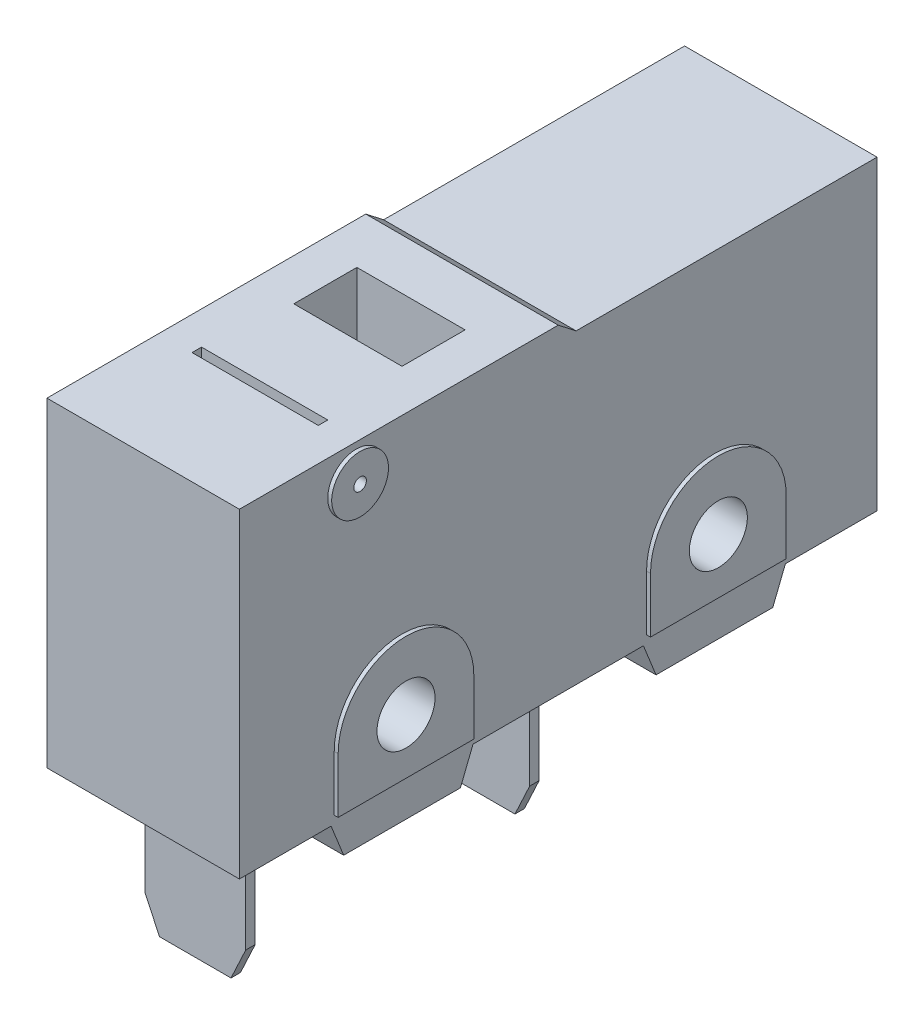
from build123d import *
from OCP.BRepFilletAPI import BRepFilletAPI_MakeChamfer

# Parameters (mm, degrees)
SKETCH1_W               = 20.21
SKETCH1_H               = 9.71
BOSS_EXTRUDE1_DEPTH     = 3.05
BOSS_EXTRUDE2_DEPTH     = 3.05
BOSS_EXTRUDE3_DEPTH     = 3.175
CUT_EXTRUDE1_DEPTH      = 13.102589599
CUT_EXTRUDE1_DEPTH_BACK = 13.102589599
MOUNTING_HOLES_R        = 0.92
SKETCH5_R               = 0.9
BOSS_EXTRUDE4_DEPTH     = 3.175
CUT_EXTRUDE2_DEPTH      = 13.102589599
CUT_EXTRUDE2_DEPTH_BACK = 13.102589599
SKETCH6_R               = 0.2
SKETCH7_W               = 4
SKETCH7_H               = 0.3
CUT_EXTRUDE3_DEPTH      = 5
SKETCH8_W               = 3.43
SKETCH8_H               = 2
CUT_EXTRUDE4_DEPTH      = 4
SKETCH9_W               = 3.2
SKETCH9_H               = 0.3
BOSS_EXTRUDE5_DEPTH     = 4.5
BOSS_EXTRUDE5_2_DEPTH   = 4.5
CHAMFER1_SIZE           = 1
CHAMFER1_SIZE2          = 0.466307658
CHAMFER2_SIZE           = 1
CHAMFER2_SIZE2          = 0.466307658


with BuildPart() as part:
    # Sketch1 → Boss-Extrude1 (new, symmetric)
    with BuildSketch(Plane(origin=(0, 0, 0), x_dir=(0, 0, -1), z_dir=(1, 0, 0))):
        Rectangle(SKETCH1_W, SKETCH1_H)
    extrude(amount=BOSS_EXTRUDE1_DEPTH, both=True)

    # Sketch4 → Boss-Extrude2 (add, symmetric)
    with BuildSketch(Plane(origin=(0, 0, 0), x_dir=(0, 0, -1), z_dir=(1, 0, 0))):
        Polygon((-7.2, -4.855), (-6.8, -5.855), (-3.1, -5.855), (-2.7, -4.855), align=None)
        Polygon((2.7, -4.855), (7.2, -4.855), (6.8, -5.855), (3.1, -5.855), align=None)
        Polygon((-10.105, 4.855), (-10.105, 5.295), (0, 5.295), (0.566278635, 4.855), align=None)
    extrude(amount=BOSS_EXTRUDE2_DEPTH, both=True)

    # Sketch3 → Boss-Extrude3 (add, symmetric)
    with BuildSketch(Plane(origin=(0, 0, 0), x_dir=(0, 0, -1), z_dir=(1, 0, 0))):
        with BuildLine():
            Line((-7.1, -2.855), (-7.1, -4.605))
            Line((-7.1, -4.605), (-2.8, -4.605))
            Line((-2.8, -4.605), (-2.8, -2.855))
            ThreePointArc((-2.8, -2.855), (-4.95, -0.705), (-7.1, -2.855))
        make_face()
        with BuildLine():
            Line((2.8, -4.605), (2.8, -2.855))
            ThreePointArc((2.8, -2.855), (4.95, -0.705), (7.1, -2.855))
            Line((7.1, -2.855), (7.1, -4.605))
            Line((7.1, -4.605), (2.8, -4.605))
        make_face()
    extrude(amount=BOSS_EXTRUDE3_DEPTH, both=True)

    # Mounting Holes → Cut-Extrude1 (cut, two sides: drawn at the far end of the back side and taken through both)
    with BuildSketch(Plane(origin=(0, 0, 0), x_dir=(0, 0, -1), z_dir=(1, 0, 0)).offset(-CUT_EXTRUDE1_DEPTH_BACK)):
        with Locations((-4.95, -2.855)):
            Circle(MOUNTING_HOLES_R)
        with Locations((4.95, -2.855)):
            Circle(MOUNTING_HOLES_R)
    extrude(amount=CUT_EXTRUDE1_DEPTH + CUT_EXTRUDE1_DEPTH_BACK, mode=Mode.SUBTRACT)

    # Sketch5 → Boss-Extrude4 (add, symmetric)
    with BuildSketch(Plane(origin=(0, 0, 0), x_dir=(0, 0, -1), z_dir=(1, 0, 0))):
        with Locations((-6.405, 4.195)):
            Circle(SKETCH5_R)
    extrude(amount=BOSS_EXTRUDE4_DEPTH, both=True)

    # Sketch6 → Cut-Extrude2 (cut, two sides: drawn at the far end of the back side and taken through both)
    with BuildSketch(Plane(origin=(0, 0, 0), x_dir=(0, 0, -1), z_dir=(1, 0, 0)).offset(-CUT_EXTRUDE2_DEPTH_BACK)):
        with Locations((-6.405, 4.195)):
            Circle(SKETCH6_R)
    extrude(amount=CUT_EXTRUDE2_DEPTH + CUT_EXTRUDE2_DEPTH_BACK, mode=Mode.SUBTRACT)

    # Sketch7 → Cut-Extrude3 (cut)
    with BuildSketch(Plane(origin=(0, 5.295, 0), x_dir=(1, 0, 0), z_dir=(0, 1, 0))):
        with Locations((0, -6.405)):
            Rectangle(SKETCH7_W, SKETCH7_H)
    extrude(amount=-CUT_EXTRUDE3_DEPTH, mode=Mode.SUBTRACT)

    # Sketch8 → Cut-Extrude4 (cut)
    with BuildSketch(Plane(origin=(0, 5.295, 0), x_dir=(1, 0, 0), z_dir=(0, 1, 0))):
        with Locations((-0.01148339, -2.605)):
            Rectangle(SKETCH8_W, SKETCH8_H)
    extrude(amount=-CUT_EXTRUDE4_DEPTH, mode=Mode.SUBTRACT)


with BuildPart() as body_2:
    # Sketch9 → Boss-Extrude5 (new body)
    with BuildSketch(Plane.XZ.offset(4.855)):
        with Locations((0, 8.305)):
            Rectangle(SKETCH9_W, SKETCH9_H)
    extrude(amount=BOSS_EXTRUDE5_DEPTH)

    # Chamfer2: one chamfer whose edges measure the first distance from different faces: ONE call of the kernel's chamfer builder (chamfer() names one face for all edges)
    chamfer2_edges_1 = [body_2.edges().sort_by_distance(p)[0] for p in [
        (1.6, -9.355, 8.305),
    ]]
    chamfer2_side_1 = [body_2.faces().sort_by_distance(p)[0] for p in [
        (1.6, -7.105, 8.305),
    ]]
    chamfer2_edges_2 = [body_2.edges().sort_by_distance(p)[0] for p in [
        (-1.6, -9.355, 8.305),
    ]]
    chamfer2_side_2 = [body_2.faces().sort_by_distance(p)[0] for p in [
        (-1.6, -7.105, 8.305),
    ]]
    chamfer2 = BRepFilletAPI_MakeChamfer(body_2.part.solid().wrapped)
    for e in chamfer2_edges_1:
        chamfer2.Add(CHAMFER2_SIZE, CHAMFER2_SIZE2, e.wrapped, chamfer2_side_1[0].wrapped)  # the first distance lies on this face
    for e in chamfer2_edges_2:
        chamfer2.Add(CHAMFER2_SIZE, CHAMFER2_SIZE2, e.wrapped, chamfer2_side_2[0].wrapped)  # the first distance lies on this face
    add(Compound.cast(chamfer2.Shape()), mode=Mode.REPLACE)


with BuildPart() as body_3:
    # Sketch9 → Boss-Extrude5 2 (new body)
    with BuildSketch(Plane.XZ.offset(4.855)):
        with Locations((0, -0.695)):
            Rectangle(SKETCH9_W, SKETCH9_H)
    extrude(amount=BOSS_EXTRUDE5_2_DEPTH)

    # Chamfer1: one chamfer whose edges measure the first distance from different faces: ONE call of the kernel's chamfer builder (chamfer() names one face for all edges)
    chamfer1_edges_1 = [body_3.edges().sort_by_distance(p)[0] for p in [
        (1.6, -9.355, -0.695),
    ]]
    chamfer1_side_1 = [body_3.faces().sort_by_distance(p)[0] for p in [
        (1.6, -7.105, -0.695),
    ]]
    chamfer1_edges_2 = [body_3.edges().sort_by_distance(p)[0] for p in [
        (-1.6, -9.355, -0.695),
    ]]
    chamfer1_side_2 = [body_3.faces().sort_by_distance(p)[0] for p in [
        (-1.6, -7.105, -0.695),
    ]]
    chamfer1 = BRepFilletAPI_MakeChamfer(body_3.part.solid().wrapped)
    for e in chamfer1_edges_1:
        chamfer1.Add(CHAMFER1_SIZE, CHAMFER1_SIZE2, e.wrapped, chamfer1_side_1[0].wrapped)  # the first distance lies on this face
    for e in chamfer1_edges_2:
        chamfer1.Add(CHAMFER1_SIZE, CHAMFER1_SIZE2, e.wrapped, chamfer1_side_2[0].wrapped)  # the first distance lies on this face
    add(Compound.cast(chamfer1.Shape()), mode=Mode.REPLACE)


solid = Compound([part.part, body_2.part, body_3.part])
